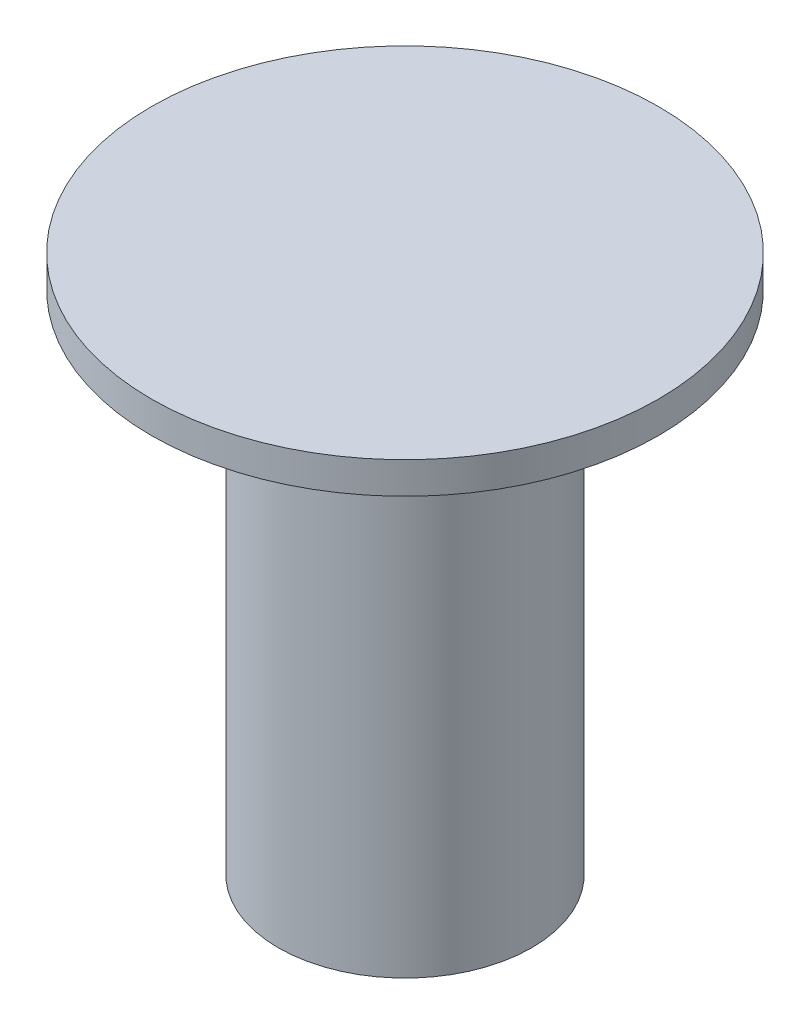
from build123d import *

# Parameters (mm, degrees)
SKETCH_1_R      = 8
EXTRUDE_1_DEPTH = 32
SKETCH_2_R      = 16
EXTRUDE_2_DEPTH = 2


with BuildPart() as part:
    # 草图1 → 凸台-拉伸1 (new body)
    with BuildSketch(Plane(origin=(0, 0, 0), x_dir=(1, 0, 0), z_dir=(0, 1, 0))):
        with Locations(Location((0, 0, 0), (0, 0, 270))):
            Circle(SKETCH_1_R)
    extrude(amount=EXTRUDE_1_DEPTH)

    # 草图2 → 凸台-拉伸2 (add)
    with BuildSketch(Plane(origin=(0, 32, 0), x_dir=(1, 0, 0), z_dir=(0, 1, 0))):
        with Locations(Location((0, 0, 0), (0, 0, 270))):
            Circle(SKETCH_2_R)
    extrude(amount=EXTRUDE_2_DEPTH)


solid = part.part
